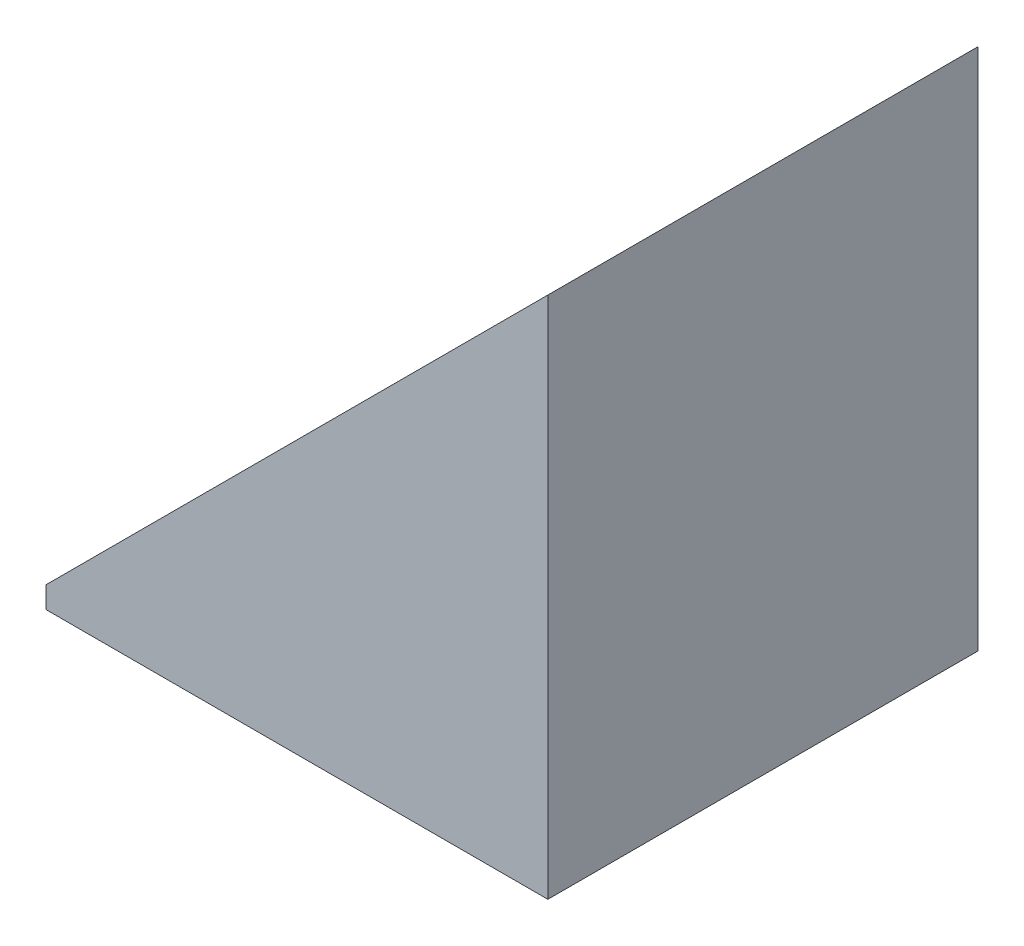
from build123d import *

# Parameters (mm, degrees)
EXTRUDE_1_DEPTH     = 60
SKETCH_2_R          = 0.85
CUT_EXTRUDE_1_DEPTH = 30


with BuildPart() as part:
    # 草图1 → 凸台-拉伸1 (new body)
    with BuildSketch(Plane.XY):
        Polygon((0, 0), (70, 0), (70, 73), (0, 3), align=None)
    extrude(amount=EXTRUDE_1_DEPTH)

    # 草图2 → 切除-拉伸1 (cut, symmetric)
    with BuildSketch(Plane(origin=(-1.5, 1.5, 0), x_dir=(0, 0, 1), z_dir=(-0.7071067811865512, 0.7071067811865438, 0))):
        with Locations(Location((19.503, 42.497795027, 0), (0, 0, 270))):
            Circle(SKETCH_2_R)
        with Locations(Location((23.123, 63.505795027, 0), (0, 0, 270))):
            Circle(SKETCH_2_R)
        with Locations(Location((40.502, 59.078795027, 0), (0, 0, 270))):
            Circle(SKETCH_2_R)
        with Locations(Location((37.391, 40.877795027, 0), (0, 0, 270))):
            Circle(SKETCH_2_R)
    extrude(amount=CUT_EXTRUDE_1_DEPTH, both=True, mode=Mode.SUBTRACT)


solid = part.part
